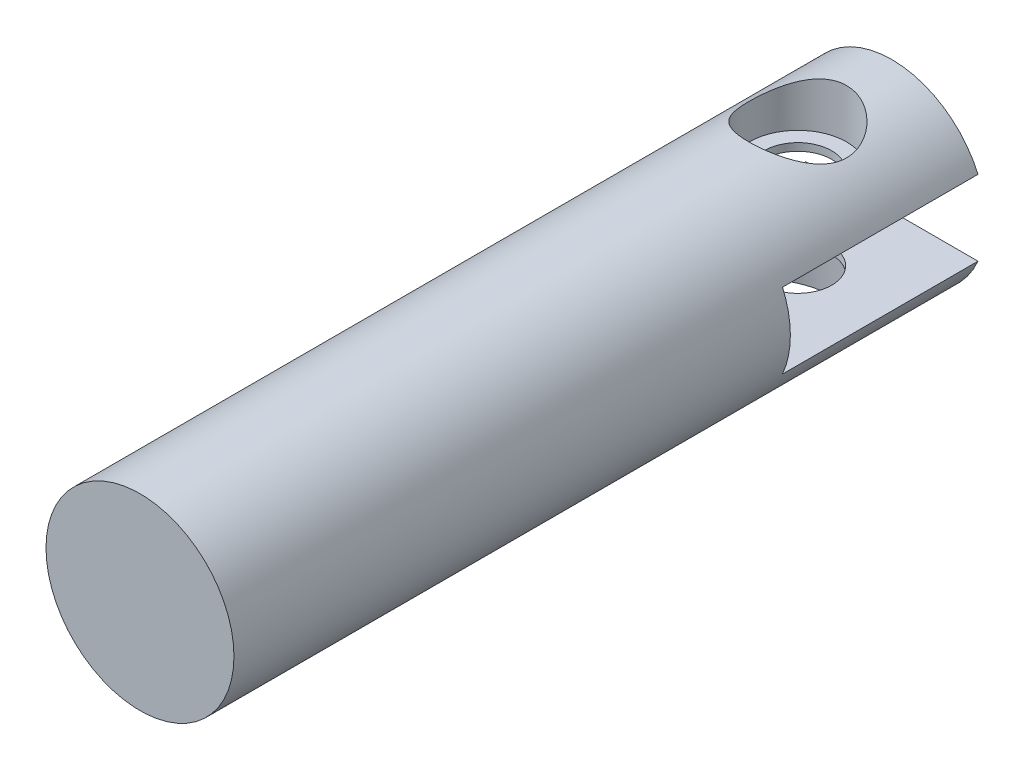
from build123d import *

# Parameters (mm, degrees)
SKETCH_1_R               = 12.5
EXTRUDE_1_DEPTH          = 100
CUT_EXTRUDE_START        = -26
CUT_EXTRUDE_1_DEPTH      = 26
CUT_EXTRUDE_2_DEPTH      = 34
CUT_EXTRUDE_2_DEPTH_BACK = 36.534771414
SKETCH_3_R               = 4.5
SKETCH_6_R               = 6.5
CUT_EXTRUDE_5_DEPTH      = 16


with BuildPart() as part:
    # 스케치1 → 보스-돌출1 (new body)
    with BuildSketch(Plane.XY):
        Circle(SKETCH_1_R)
    extrude(amount=-EXTRUDE_1_DEPTH)

    # 스케치2 → 컷-돌출1 (cut)
    with BuildSketch(Plane(origin=(0, 0, -100), x_dir=(-1, 0, 0), z_dir=(0, 0, -1)).offset(CUT_EXTRUDE_START)):
        with BuildLine():
            Line((11.456439237, 5), (-11.456439237, 5))
            ThreePointArc((-11.456439237, 5), (-12.5, 0), (-11.456439237, -5))
            Line((-11.456439237, -5), (11.456439237, -5))
            ThreePointArc((11.456439237, -5), (12.5, 0), (11.456439237, 5))
        make_face()
    extrude(amount=CUT_EXTRUDE_1_DEPTH, mode=Mode.SUBTRACT)

    # 스케치3 → 컷-돌출2 (cut, two sides: drawn at the far end of the back side and taken through both)
    with BuildSketch(Plane(origin=(0, 0, 0), x_dir=(1, 0, 0), z_dir=(0, 1, 0)).offset(-CUT_EXTRUDE_2_DEPTH_BACK)):
        with Locations(Location((0, 87.5, 0), (0, 0, 90))):
            Circle(SKETCH_3_R)
    extrude(amount=CUT_EXTRUDE_2_DEPTH + CUT_EXTRUDE_2_DEPTH_BACK, mode=Mode.SUBTRACT)

    # 스케치6 → 컷-돌출5 (cut)
    with BuildSketch(Plane(origin=(0, 6, 0), x_dir=(1, 0, 0), z_dir=(0, 1, 0))):
        with Locations(Location((0, 87.5, 0), (0, 0, 90))):
            Circle(SKETCH_6_R)
    cut_extrude_5 = extrude(amount=CUT_EXTRUDE_5_DEPTH, mode=Mode.SUBTRACT)

    # 대칭 복사1: 컷-돌출5 across plane
    add(cut_extrude_5.mirror(Plane.ZX), mode=Mode.SUBTRACT)


solid = part.part
